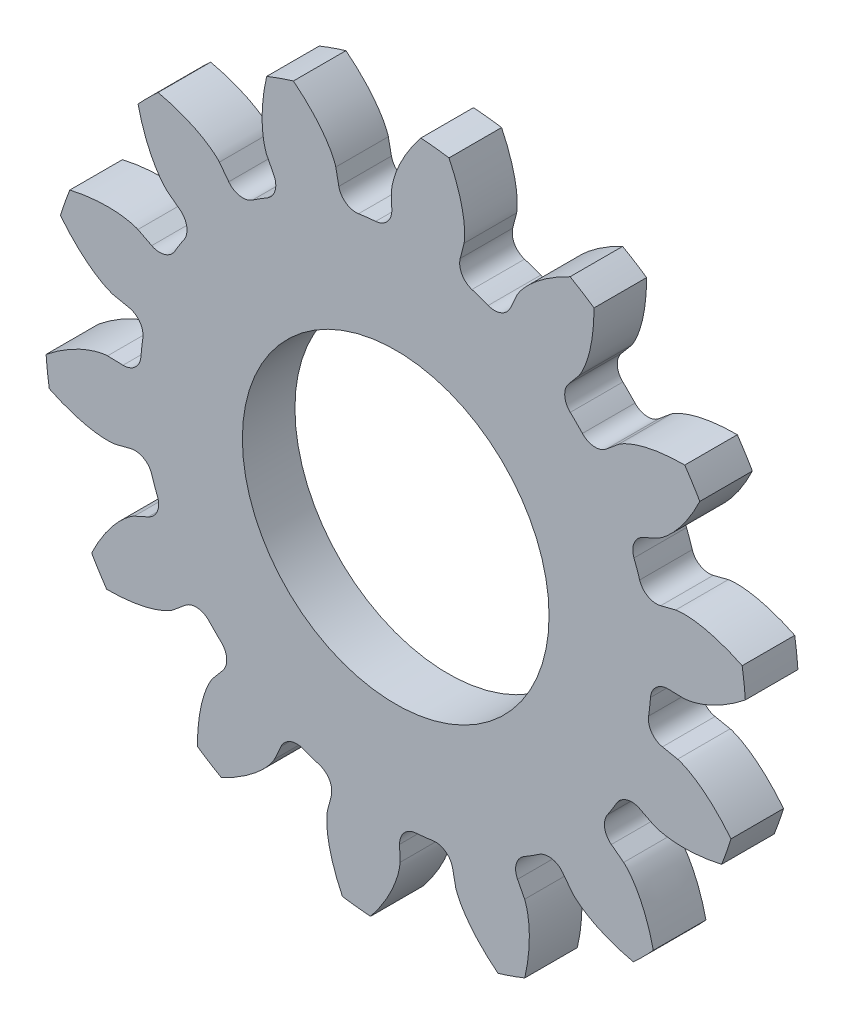
from build123d import *

# Parameters (mm, degrees)
SKETCH1_R                = 58.333333333
BOSS_EXTRUDE1_DEPTH      = 12
BOSS_EXTRUDE2_DEPTH      = 12
FILLET1_R                = 4
CIRPATTERN1_COUNT        = 14
FILLET1_OF_CIRPATTERN1_R = 4
SKETCH3_R                = 35
CUT_EXTRUDE1_DEPTH       = 114.481604361


with BuildPart() as part:
    # Sketch1 → Boss-Extrude1 (new body)
    with BuildSketch(Plane.XY):
        Circle(SKETCH1_R)
    extrude(amount=BOSS_EXTRUDE1_DEPTH)

    # Sketch2 → Boss-Extrude2 (add)
    with BuildSketch(Plane.XY):
        with BuildLine():
            add(Edge.make_bspline(
                [(-0.977395006, 65.771221554), (-0.978344364, 65.810580248), (-0.978065883, 66.013083904), (-0.923172989, 66.503557708), (-0.783450426, 67.361755401), (-0.483147829, 68.576336651), (-0.185701356, 69.489489688), (0, 70)],
                knots=[0, 0, 0, 0, 0.006482082, 0.033374777, 0.081141929, 0.149783624, 0.239299888, 0.239299888, 0.239299888, 0.239299888], degree=3))
            Line((-0.977395006, 65.771221554), (-0.797856428, 58.327876722))
            ThreePointArc((-0.797856428, 58.327876722), (6.531261106, 57.966545577), (13.757026106, 56.687935317))
            Line((13.757026106, 56.687935317), (15.58836332, 63.904708861))
            add(Edge.make_bspline(
                [(15.58836332, 63.904708861), (15.59804701, 63.942869499), (15.642836813, 64.140357934), (15.698460887, 64.630749353), (15.753208413, 65.498521433), (15.730704783, 66.74947421), (15.583331797, 68.373499656), (15.250219371, 70.357163302), (14.677935129, 72.679280316), (13.81298011, 75.312937575), (12.91878045, 77.470511634), (12.316279972, 78.746373752), (12.158399476, 79.070685606)],
                knots=[0, 0, 0, 0, 0.006482082, 0.033374777, 0.081141929, 0.149783624, 0.239299888, 0.349690732, 0.480956162, 0.633096183, 0.806110795, 0.865537009, 0.865537009, 0.865537009, 0.865537009], degree=3))
            ThreePointArc((12.158399476, 79.070685606), (8.957158088, 79.496976791), (5.741319793, 79.793716839))
            add(Edge.make_bspline(
                [(0, 70), (0.229005642, 70.629557824), (0.788077156, 71.986655383), (1.862732685, 74.123206851), (3.292045348, 76.498362225), (4.64393095, 78.402863255), (5.515231514, 79.512667876), (5.741319793, 79.793716839)],
                knots=[0.239299888, 0.239299888, 0.239299888, 0.239299888, 0.349690732, 0.480956162, 0.633096183, 0.806110795, 0.865537009, 0.865537009, 0.865537009, 0.865537009], degree=3))
        make_face()
    boss_extrude2 = extrude(amount=BOSS_EXTRUDE2_DEPTH)

    # Fillet1
    fillet1_edges = [part.edges().sort_by_distance(p)[0] for p in [
        (13.757026106, 56.687935317, 6),
        (-0.797856428, 58.327876722, 6),
    ]]
    fillet(fillet1_edges, radius=FILLET1_R)

    # CirPattern1: Boss-Extrude2 ×14 about axis
    cirpattern1_axis = Axis((0, 0, 12), (0, 0, 1))
    for i in range(1, CIRPATTERN1_COUNT):
        add(boss_extrude2.rotate(cirpattern1_axis, i * 360 / CIRPATTERN1_COUNT))

    # Fillet1 of CirPattern1
    fillet1_of_cirpattern1_edges = [part.edges().sort_by_distance(p)[0] for p in [
        (-12.201321102, 57.043014832, 6),
        (-26.02636105, 52.205424127, 6),
        (-35.743047026, 46.100025673, 6),
        (-46.100025673, 35.743047026, 6),
        (-52.205424127, 26.02636105, 6),
        (-57.043014832, 12.201321102, 6),
        (-58.327876722, 0.797856428, 6),
        (-56.687935317, -13.757026106, 6),
        (-52.897777988, -24.588673444, 6),
        (-45.10511498, -36.990625574, 6),
        (-36.990625574, -45.10511498, 6),
        (-24.588673444, -52.897777988, 6),
        (-13.757026106, -56.687935317, 6),
        (0.797856428, -58.327876722, 6),
        (12.201321102, -57.043014832, 6),
        (26.02636105, -52.205424127, 6),
        (35.743047026, -46.100025673, 6),
        (46.100025673, -35.743047026, 6),
        (52.205424127, -26.02636105, 6),
        (57.043014832, -12.201321102, 6),
        (58.327876722, -0.797856428, 6),
        (56.687935317, 13.757026106, 6),
        (52.897777988, 24.588673444, 6),
        (45.10511498, 36.990625574, 6),
        (36.990625574, 45.10511498, 6),
        (24.588673444, 52.897777988, 6),
    ]]
    fillet(fillet1_of_cirpattern1_edges, radius=FILLET1_OF_CIRPATTERN1_R)

    # Sketch3 → Cut-Extrude1 (cut, through all)
    with BuildSketch(Plane.XY.offset(12)):
        Circle(SKETCH3_R)
    extrude(amount=-CUT_EXTRUDE1_DEPTH, mode=Mode.SUBTRACT)


solid = part.part
